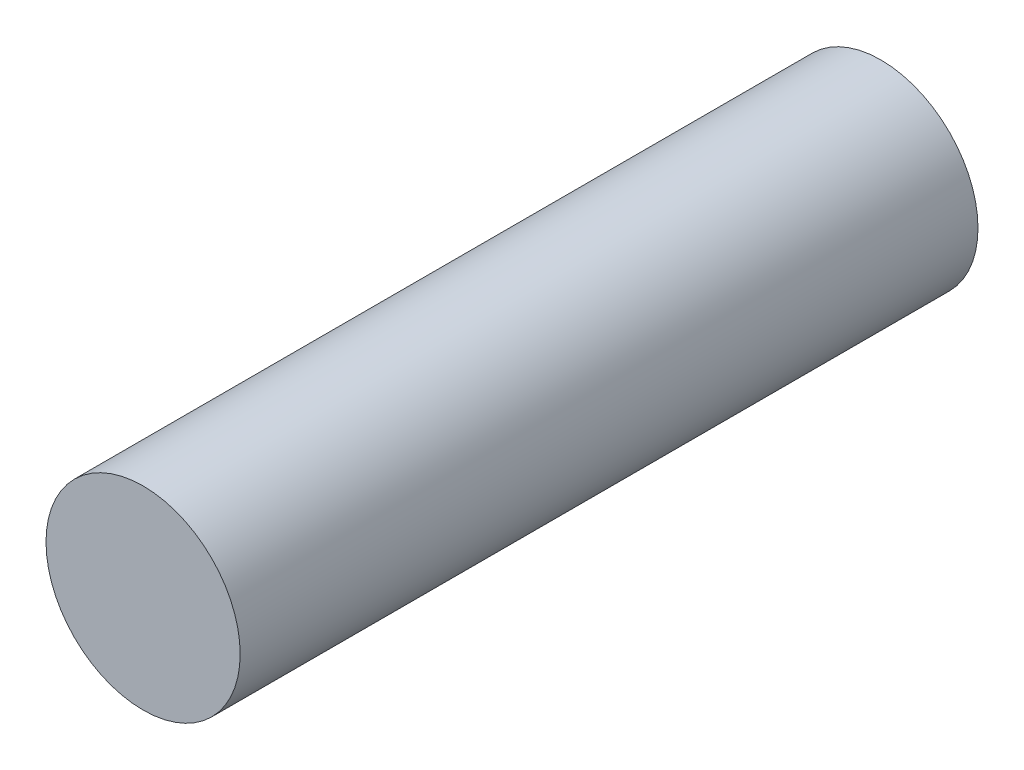
from build123d import *

# Parameters (mm, degrees)
SKETCH1_R           = 2.5
BOSS_EXTRUDE1_DEPTH = 19


with BuildPart() as part:
    # Sketch1 → Boss-Extrude1 (new body)
    with BuildSketch(Plane.XY):
        Circle(SKETCH1_R)
    extrude(amount=BOSS_EXTRUDE1_DEPTH)


solid = part.part
